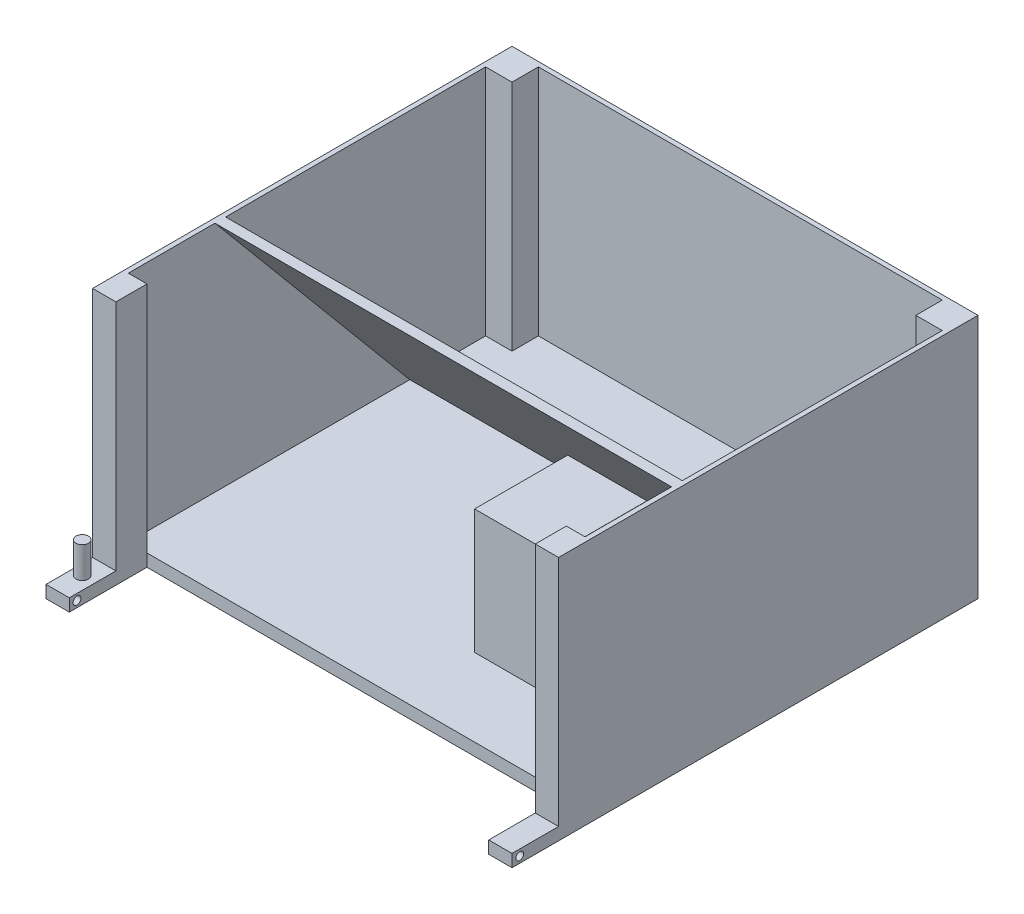
from build123d import *

# Parameters (mm, degrees)
BOSS_EXTRUDE1_DEPTH     = 8
CUT_EXTRUDE1_DEPTH      = 213.282830205
CUT_EXTRUDE1_DEPTH_BACK = 213.282830205
SKETCH2_R               = 2.5
SKETCH3_W               = 20
SKETCH3_H               = 20
SKETCH3_W_2             = 15
BOSS_EXTRUDE2_DEPTH     = 150
BOSS_EXTRUDE3_DEPTH     = 150
SKETCH5_W               = 51
SKETCH5_H               = 60
BOSS_EXTRUDE4_DEPTH     = 80
SKETCH7_R               = 4
BOSS_EXTRUDE5_DEPTH     = 20
BOSS_EXTRUDE6_REACH     = 372.761
SKETCH9_R               = 4
BOSS_EXTRUDE7_DEPTH     = 20


with BuildPart() as part:
    # Sketch1 → Boss-Extrude1 (new body)
    with BuildSketch(Plane(origin=(0, 0, 0), x_dir=(1, 0, 0), z_dir=(0, 1, 0))):
        Polygon((135, -150), (150, -150), (150, 150), (-150, 150), (-150, -150), (-135, -150), (-135, -100), (135, -100), align=None)
    extrude(amount=BOSS_EXTRUDE1_DEPTH)

    # Sketch2 → Cut-Extrude1 (cut, two sides: drawn at the far end of the back side and taken through both)
    with BuildSketch(Plane(origin=(0, 0, 0), x_dir=(0, 0, -1), z_dir=(1, 0, 0)).offset(-CUT_EXTRUDE1_DEPTH_BACK)):
        with Locations((-145.033528283, 4)):
            Circle(SKETCH2_R)
    extrude(amount=CUT_EXTRUDE1_DEPTH + CUT_EXTRUDE1_DEPTH_BACK, mode=Mode.SUBTRACT)

    # Sketch3 → Boss-Extrude2 (add)
    with BuildSketch(Plane(origin=(0, 8, 0), x_dir=(1, 0, 0), z_dir=(0, 1, 0))):
        with Locations((-140, 140)):
            Rectangle(SKETCH3_W, SKETCH3_H)
        with Locations((140, 140)):
            Rectangle(SKETCH3_W, SKETCH3_H)
        with Locations((142.5, -110)):
            Rectangle(SKETCH3_W_2, SKETCH3_H)
        with Locations((-142.5, -110)):
            Rectangle(SKETCH3_W_2, SKETCH3_H)
    extrude(amount=BOSS_EXTRUDE2_DEPTH)

    # Sketch4 → Boss-Extrude3 (add)
    with BuildSketch(Plane(origin=(0, 8, 0), x_dir=(1, 0, 0), z_dir=(0, 1, 0))):
        Polygon((-147, 147), (-147, -117), (-150, -120), (-150, 150), (150, 150), (150, -120), (147, -117), (147, 147), align=None)
    extrude(amount=BOSS_EXTRUDE3_DEPTH)

    # Sketch5 → Boss-Extrude4 (add)
    with BuildSketch(Plane(origin=(0, 8, 0), x_dir=(1, 0, 0), z_dir=(0, 1, 0))):
        with Locations((51.38892732, -20)):
            Rectangle(SKETCH5_W, SKETCH5_H)
    extrude(amount=BOSS_EXTRUDE4_DEPTH)

    # Sketch7 → Boss-Extrude5 (add)
    with BuildSketch(Plane.ZY.offset(-25.88892732)):
        with Locations(Location((20.016570429, 48, 0), (0, 0, 180))):
            Circle(SKETCH7_R)
    extrude(amount=BOSS_EXTRUDE5_DEPTH)

    # Sketch8 → Boss-Extrude6 (add, up to next)
    with BuildSketch(Plane.ZY.offset(150), mode=Mode.PRIVATE) as boss_extrude6_sk1:
        Polygon((37.367547096, 158), (-94.778166859, 0), (-87.891172035, 0), (44.254541919, 158), align=None)
    boss_extrude6_tool1 = extrude(boss_extrude6_sk1.sketch, amount=-BOSS_EXTRUDE6_REACH, mode=Mode.PRIVATE) - part.part
    add(boss_extrude6_tool1.solids().sort_by_distance((-150, 79, -25.261812))[0])

    # Sketch9 → Boss-Extrude7 (add)
    with BuildSketch(Plane(origin=(0, 8, 0), x_dir=(1, 0, 0), z_dir=(0, 1, 0))):
        with Locations(Location((-143.273126196, -133.426649838, 0), (0, 0, 270))):
            Circle(SKETCH9_R)
    extrude(amount=BOSS_EXTRUDE7_DEPTH)


solid = part.part
